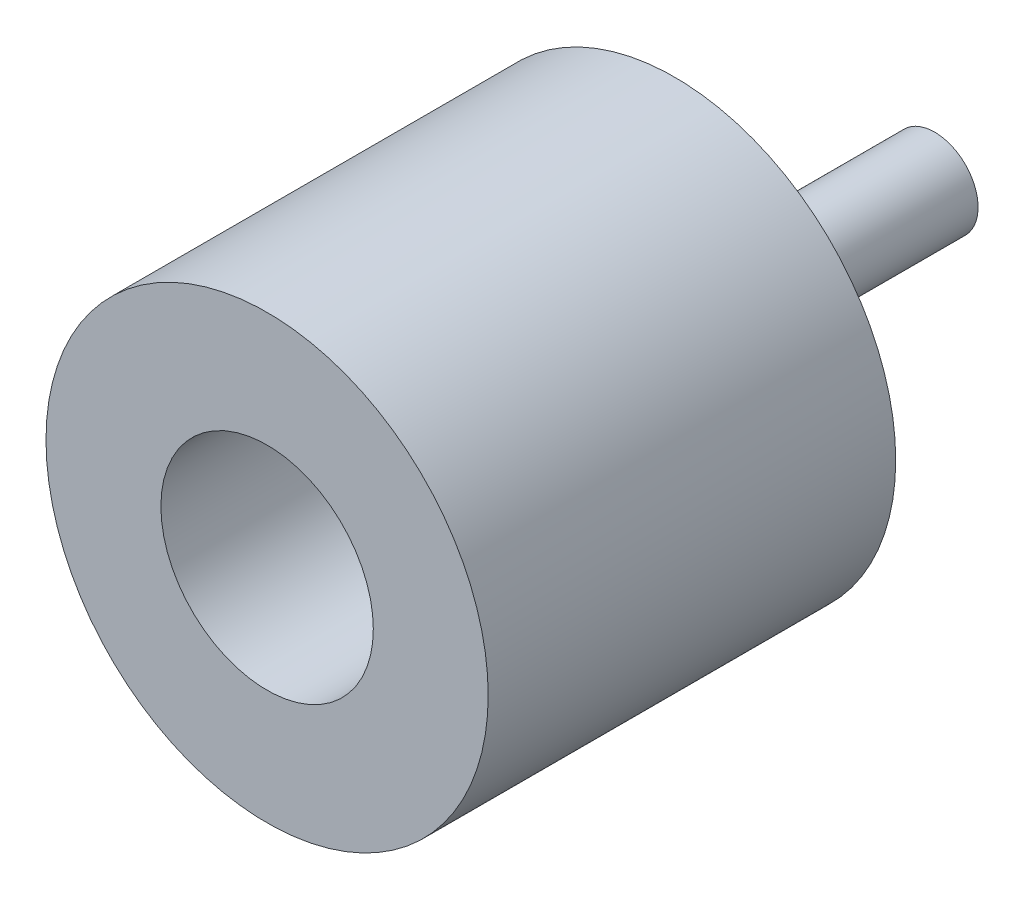
from build123d import *


with BuildPart() as part:
    # Sketch2 → Revolve1 (revolve)
    with BuildSketch(Plane(origin=(0, 0, 0), x_dir=(1, 0, 0), z_dir=(0, 1, 0)), mode=Mode.PRIVATE) as revolve1_sk:
        Polygon((1.225, -0.2), (2.55, -0.2), (2.55, 4.5), (0.5, 4.5), (0.5, 7.5), (0, 7.5), (0, 3.5), (1.225, 3.5), align=None)
    revolve(revolve1_sk.sketch.rotate(Axis((0, 0, -5.360503964), (0, 0, 1)), 180), axis=Axis((0, 0, -5.360503964), (0, 0, 1)))


solid = part.part
